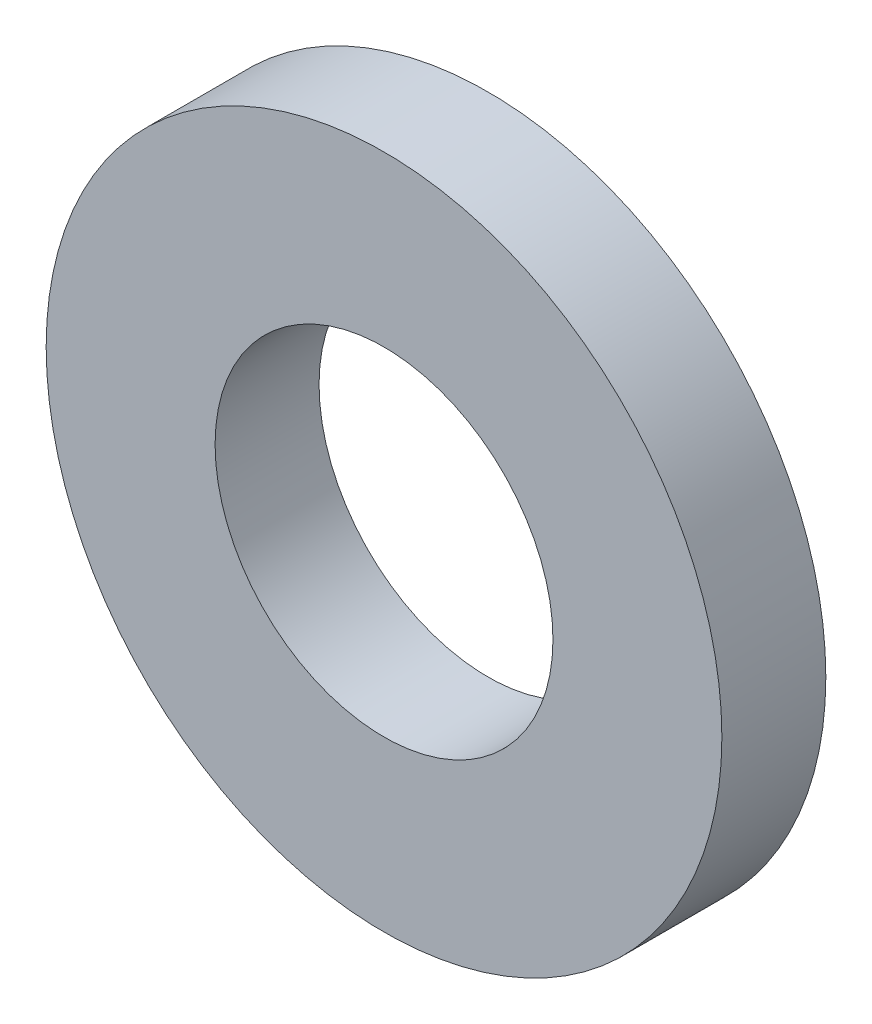
from build123d import *

# Parameters (mm, degrees)
SKETCH1_R           = 6.5
SKETCH1_R_2         = 3.25
BOSS_EXTRUDE1_DEPTH = 2


with BuildPart() as part:
    # Sketch1 → Boss-Extrude1 (new body)
    with BuildSketch(Plane.XY):
        Circle(SKETCH1_R)
        Circle(SKETCH1_R_2, mode=Mode.SUBTRACT)
    extrude(amount=BOSS_EXTRUDE1_DEPTH)


solid = part.part
